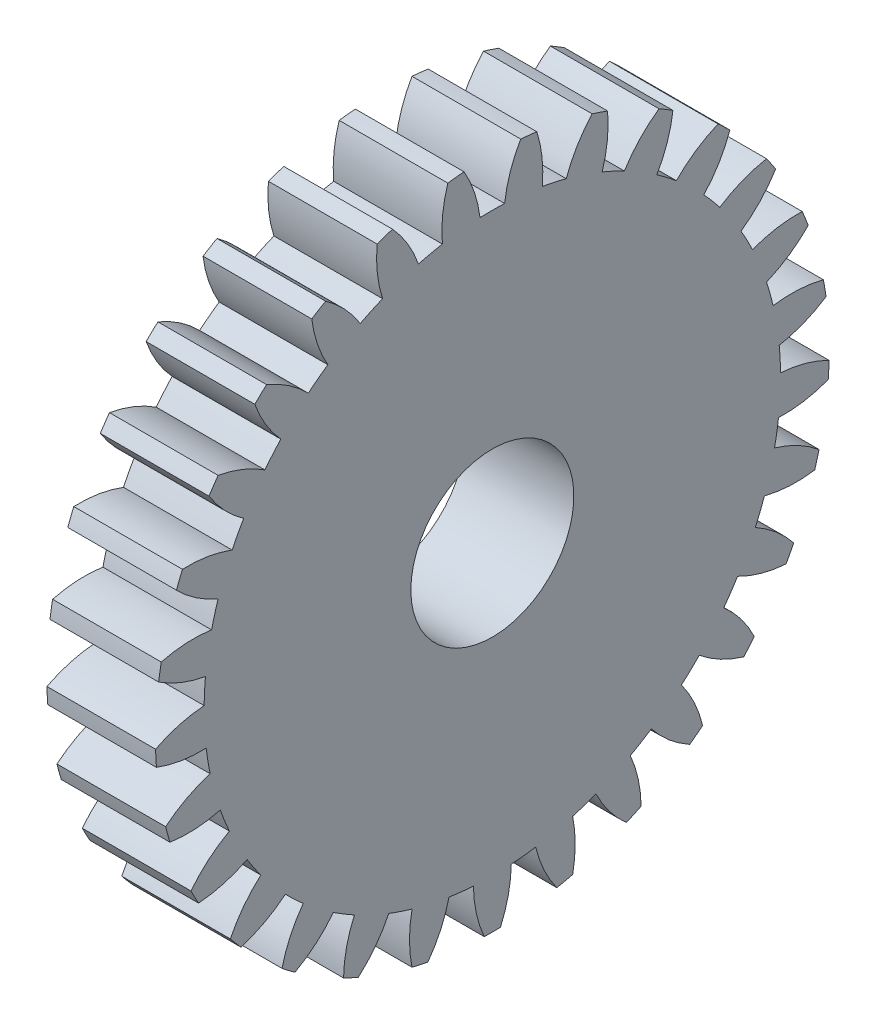
from build123d import *

# Parameters (mm, degrees)
BASPROSKE_W     = 6.35
BASPROSKE_H     = 19.685
TOOTHCUT_DEPTH  = 29.553825488
TEETHCUTS_COUNT = 29
TEETHCUTS_ANGLE = 347.586206897
BORSKE_R        = 4.7625
BORE_DEPTH      = 50.8000508


with BuildPart() as part:
    # BasProSke → Base-Revolve (revolve)
    with BuildSketch(Plane(origin=(0, 0, 0), x_dir=(1, 0, 0), z_dir=(0, 1, 0)), mode=Mode.PRIVATE) as base_revolve_sk:
        with Locations((3.175, 9.8425)):
            Rectangle(BASPROSKE_W, BASPROSKE_H)
    revolve(base_revolve_sk.sketch.rotate(Axis((-10, 0, 0), (1, 0, 0)), 180), axis=Axis((-10, 0, 0), (1, 0, 0)))

    # TooCutSke → ToothCut (cut, through all)
    with BuildSketch(Plane(origin=(0, 0, 0), x_dir=(0, 0, -1), z_dir=(1, 0, 0))):
        with BuildLine():
            ThreePointArc((0.71742494, 16.824911218), (0, 16.8402), (-0.71742494, 16.824911218))
            ThreePointArc((-0.71742494, 16.824911218), (-1.050408512, 18.280753125), (-1.670195679, 19.63950902))
            ThreePointArc((-1.670195679, 19.63950902), (0, 19.7104), (1.670195679, 19.63950902))
            ThreePointArc((1.670195679, 19.63950902), (1.050408512, 18.280753125), (0.71742494, 16.824911218))
        make_face()
    toothcut = extrude(amount=TOOTHCUT_DEPTH, mode=Mode.SUBTRACT)

    # TeethCuts: ToothCut ×29 about axis
    teethcuts_axis = Axis((-10, 0, 0), (1, 0, 0))
    for i in range(1, TEETHCUTS_COUNT):
        add(toothcut.rotate(teethcuts_axis, i * TEETHCUTS_ANGLE / (TEETHCUTS_COUNT - 1)), mode=Mode.SUBTRACT)

    # BorSke → Bore (cut, symmetric)
    with BuildSketch(Plane(origin=(0, 0, 0), x_dir=(0, 0, -1), z_dir=(1, 0, 0))):
        with Locations(Location((0, 0, 0), (0, 0, 180))):
            Circle(BORSKE_R)
    extrude(amount=BORE_DEPTH, both=True, mode=Mode.SUBTRACT)


solid = part.part
